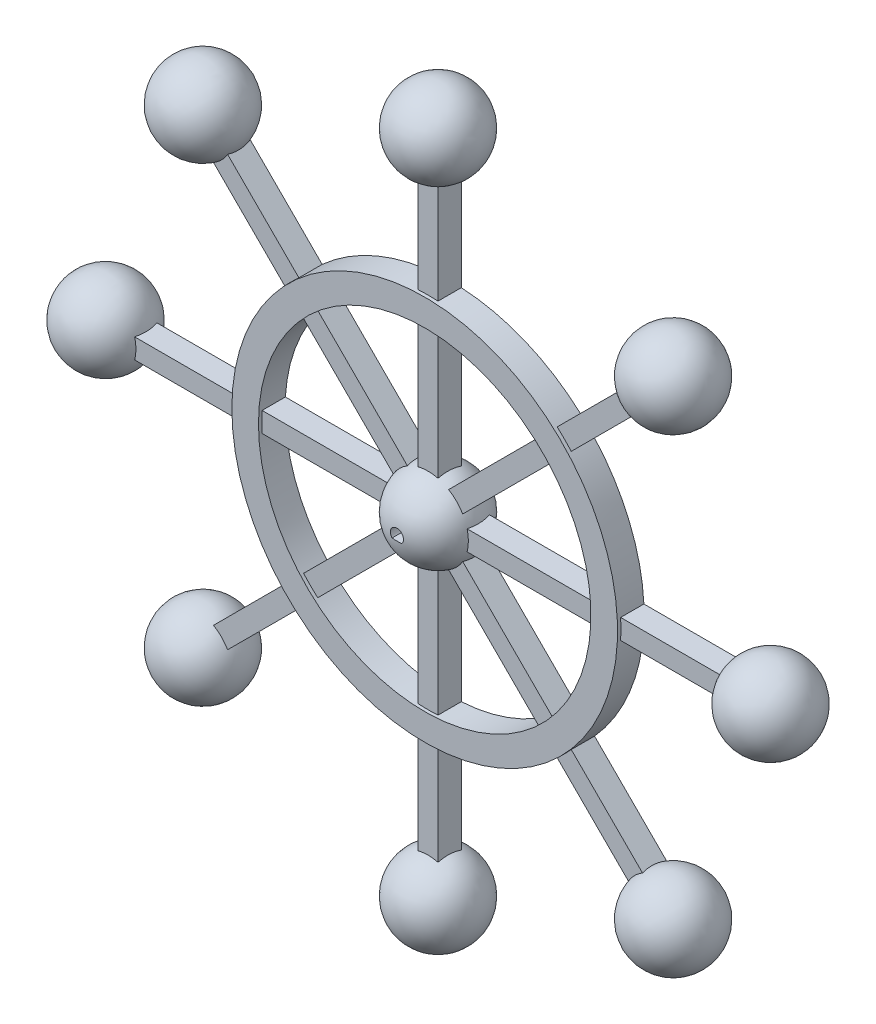
from build123d import *

# Parameters (mm, degrees)
BOSS_EXTRUDE1_START     = -5.08
SKETCH2_W               = 127
SKETCH2_H               = 7.62
BOSS_EXTRUDE1_DEPTH     = 8.89
CIRPATTERN1_COUNT       = 8
SKETCH5_R               = 73.66
SKETCH5_R_2             = 63.5
BOSS_EXTRUDE2_DEPTH     = 10.16
CUT_EXTRUDE1_DEPTH      = 181.823427755
CUT_EXTRUDE1_DEPTH_BACK = 181.823427755
CIRPATTERN2_COUNT       = 8


with BuildPart() as part:
    # Sketch1 → Revolve1 (revolve)
    with BuildSketch(Plane.XY):
        with BuildLine():
            Line((0, 15.875), (0, -15.875))
            ThreePointArc((0, -15.875), (15.875, 0), (0, 15.875))
        make_face()
    revolve(axis=Axis((0, 15.875, 0), (0, -1, 0)))

    # Sketch2 → Boss-Extrude1 (add)
    with BuildSketch(Plane.XY.offset(BOSS_EXTRUDE1_START)):
        with Locations((63.5, 0)):
            Rectangle(SKETCH2_W, SKETCH2_H)
    boss_extrude1 = extrude(amount=BOSS_EXTRUDE1_DEPTH)

    # CirPattern1: Boss-Extrude1 ×8 about axis
    cirpattern1_axis = Axis((0, 0, 0), (0, 0, 1))
    for i in range(1, CIRPATTERN1_COUNT):
        add(boss_extrude1.rotate(cirpattern1_axis, i * 360 / CIRPATTERN1_COUNT))

    # Sketch5 → Boss-Extrude2 (add)
    with BuildSketch(Plane(origin=(0, 0, -5.08), x_dir=(-1, 0, 0), z_dir=(0, 0, -1))):
        Circle(SKETCH5_R)
        Circle(SKETCH5_R_2, mode=Mode.SUBTRACT)
    extrude(amount=-BOSS_EXTRUDE2_DEPTH)

    # Sketch6 → Cut-Extrude1 (cut, two sides: drawn at the far end of the back side and taken through both)
    with BuildSketch(Plane(origin=(0, 0, -5.08), x_dir=(-1, 0, 0), z_dir=(0, 0, -1)).offset(-CUT_EXTRUDE1_DEPTH_BACK)):
        with BuildLine():
            Line((-1.855488288, -1.67829283), (1.855488288, -1.67829283))
            ThreePointArc((1.855488288, -1.67829283), (0, 2.5019), (-1.855488288, -1.67829283))
        make_face()
    extrude(amount=CUT_EXTRUDE1_DEPTH + CUT_EXTRUDE1_DEPTH_BACK, mode=Mode.SUBTRACT)

    # Sketch7 → Revolve2 (revolve)
    with BuildSketch(Plane.XY):
        with BuildLine():
            Line((0, 111.125), (0, 142.875))
            ThreePointArc((0, 142.875), (15.875, 127), (0, 111.125))
        make_face()
    revolve2 = revolve(axis=Axis((0, 111.125, 0), (0, 1, 0)))

    # CirPattern2: Revolve2 ×8 about axis
    cirpattern2_axis = Axis((0, 0, 0), (0, 0, 1))
    for i in range(1, CIRPATTERN2_COUNT):
        add(revolve2.rotate(cirpattern2_axis, i * 360 / CIRPATTERN2_COUNT))


solid = part.part
